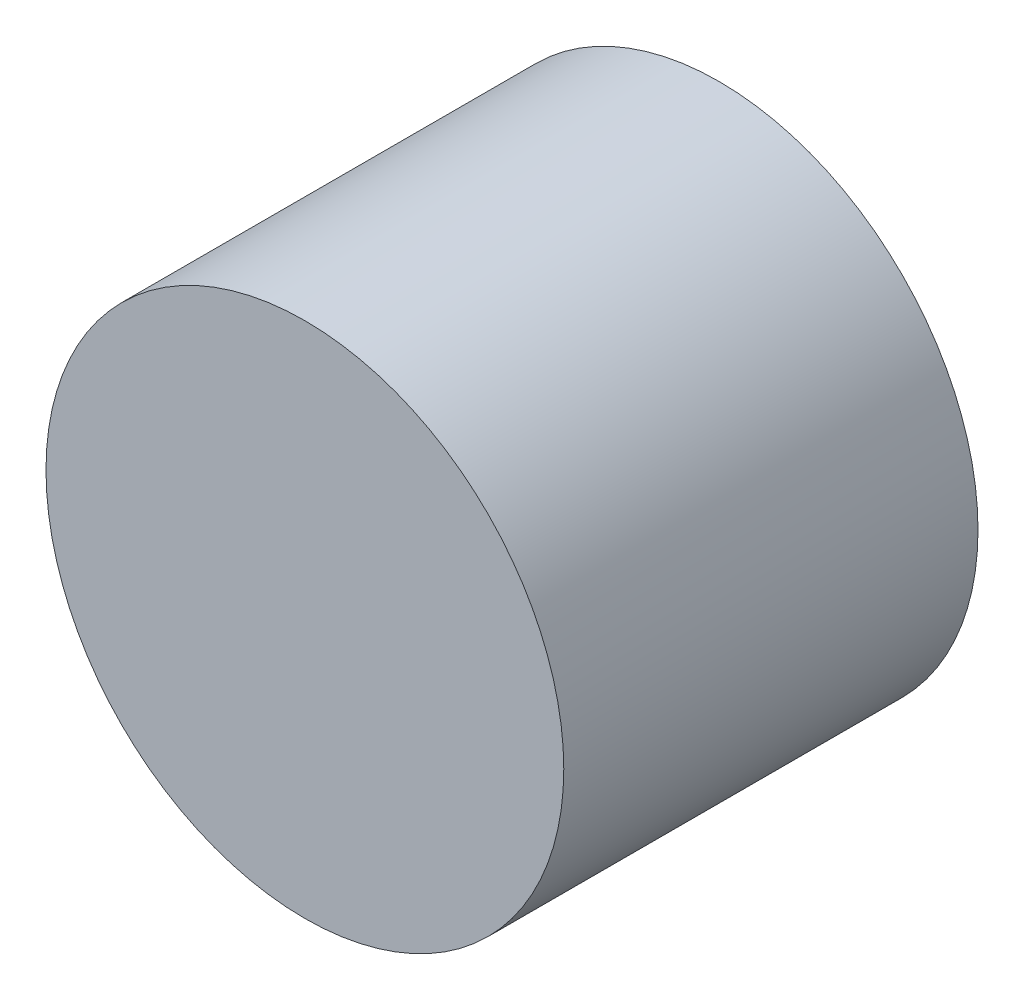
from build123d import *

# Parameters (mm, degrees)
P_IDAT_VYSUNUT_M1_DEPTH      = 2.001238
P_IDAT_VYSUNUT_M1_DEPTH_BACK = 1.998763
SKICA1_R                     = 2.5


with BuildPart() as part:
    # Skica1 → Přidat vysunutím1 (new, two sides: drawn at the far end of the back side and taken through both)
    with BuildSketch(Plane.XY.offset(-P_IDAT_VYSUNUT_M1_DEPTH_BACK)):
        with Locations((-20.153796061, 15.502860272)):
            Circle(SKICA1_R)
    extrude(amount=P_IDAT_VYSUNUT_M1_DEPTH + P_IDAT_VYSUNUT_M1_DEPTH_BACK)


solid = part.part
